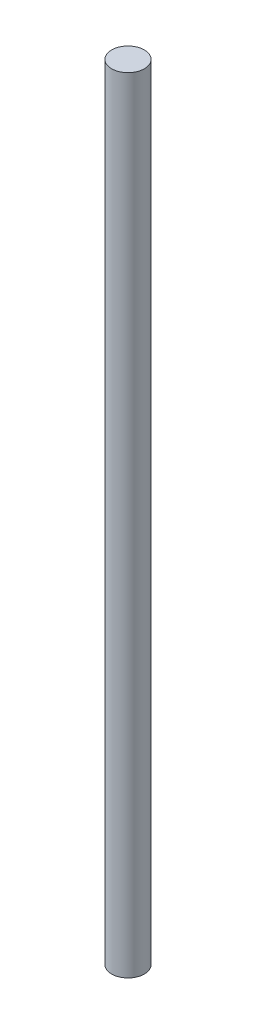
from build123d import *

# Parameters (mm, degrees)
SKETCH2_R           = 1.25
BOSS_EXTRUDE1_DEPTH = 60


with BuildPart() as part:
    # Sketch2 → Boss-Extrude1 (new body)
    with BuildSketch(Plane(origin=(0, 0, 0), x_dir=(1, 0, 0), z_dir=(0, 1, 0))):
        with Locations(Location((0, 0, 0), (0, 0, 90))):
            Circle(SKETCH2_R)
    extrude(amount=BOSS_EXTRUDE1_DEPTH)


solid = part.part
